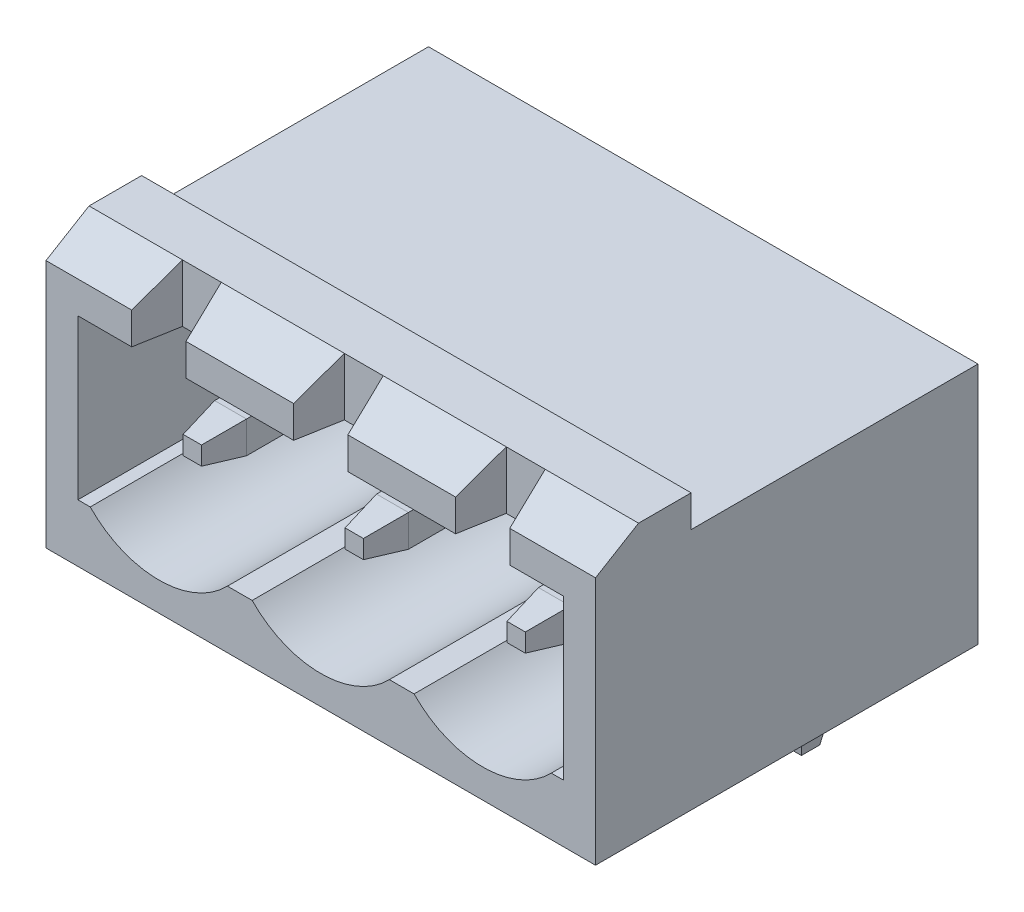
from build123d import *

# Parameters (mm, degrees)
SKETCH1_W           = 17.24
SKETCH1_H           = 7.62
BOSS_EXTRUDE1_DEPTH = 6
BOSS_EXTRUDE6_DEPTH = 17.24
CUT_EXTRUDE1_DEPTH  = 11.2
BOSS_EXTRUDE2_START = 2.5
BOSS_EXTRUDE2_DEPTH = 2.5
SKETCH4_R           = 1
BOSS_EXTRUDE3_DEPTH = 0.7
SKETCH5_W           = 1
SKETCH5_H           = 1
BOSS_EXTRUDE4_DEPTH = 5.75
SKETCH6_W           = 1
SKETCH6_H           = 1
BOSS_EXTRUDE5_DEPTH = 1.2
BOSS_EXTRUDE5_TAPER = 10
CUT_EXTRUDE2_START  = -1.81
CUT_EXTRUDE2_DEPTH  = 1.81
SKETCH10_W          = 1
SKETCH10_H          = 1
BOSS_EXTRUDE7_DEPTH = 2.3
SKETCH11_W          = 1
SKETCH11_H          = 1
BOSS_EXTRUDE8_DEPTH = 1.2
BOSS_EXTRUDE8_TAPER = 10
SKETCH12_W          = 2
SKETCH12_H          = 6.75
CUT_EXTRUDE3_DEPTH  = 0.5
LPATTERN1_COUNT     = 3
LPATTERN1_PITCH     = 5.08
LPATTERN2_COUNT     = 3
LPATTERN2_PITCH     = 5.08


with BuildPart() as part:
    # Sketch1 → Boss-Extrude1 (new, symmetric)
    with BuildSketch(Plane.XY):
        Rectangle(SKETCH1_W, SKETCH1_H)
    extrude(amount=BOSS_EXTRUDE1_DEPTH, both=True)

    # Sketch7 → Boss-Extrude6 (add)
    with BuildSketch(Plane(origin=(8.62, 0, 0), x_dir=(0, 0, -1), z_dir=(1, 0, 0))):
        Polygon((-6, 3.81), (-6, 4), (-4.65, 4.81), (-3, 4.81), (-3, 3.81), align=None)
    extrude(amount=-BOSS_EXTRUDE6_DEPTH)

    # Sketch2 → Cut-Extrude1 (cut)
    with BuildSketch(Plane.XY.offset(6)):
        with BuildLine():
            Line((2.927815064, -2), (2.54, -2))
            Line((2.54, -2), (2.54, 3))
            Line((2.54, 3), (7.62, 3))
            Line((7.62, 3), (7.62, -2))
            Line((7.62, -2), (7.232184936, -2))
            ThreePointArc((7.232184936, -2), (5.08, -2.91), (2.927815064, -2))
        make_face()
    cut_extrude1 = extrude(amount=-CUT_EXTRUDE1_DEPTH, mode=Mode.SUBTRACT)

    # Sketch3 → Boss-Extrude2 (add)
    with BuildSketch(Plane.XY.offset(-5.2).offset(BOSS_EXTRUDE2_START)):
        with BuildLine():
            Line((4.08, -1.028033989), (4.08, -2.738427125))
            ThreePointArc((4.08, -2.738427125), (5.08, -2.91), (6.08, -2.738427125))
            Line((6.08, -2.738427125), (6.08, -1.028033989))
            ThreePointArc((6.08, -1.028033989), (6.393299556, -0.634737384), (6.559019946, -0.16))
            Line((6.559019946, -0.16), (7.62, -0.16))
            Line((7.62, -0.16), (7.62, 0.34))
            Line((7.62, 0.34), (6.559019946, 0.34))
            ThreePointArc((6.559019946, 0.34), (6.140660172, 1.150660172), (5.33, 1.569019946))
            Line((5.33, 1.569019946), (5.33, 3))
            Line((5.33, 3), (4.83, 3))
            Line((4.83, 3), (4.83, 1.569019946))
            ThreePointArc((4.83, 1.569019946), (4.019339828, 1.150660172), (3.600980054, 0.34))
            Line((3.600980054, 0.34), (2.54, 0.34))
            Line((2.54, 0.34), (2.54, -0.16))
            Line((2.54, -0.16), (3.600980054, -0.16))
            ThreePointArc((3.600980054, -0.16), (3.766700444, -0.634737384), (4.08, -1.028033989))
        make_face()
    boss_extrude2 = extrude(amount=-BOSS_EXTRUDE2_DEPTH)

    # Sketch4 → Boss-Extrude3 (add)
    with BuildSketch(Plane.XY.offset(-2.7)):
        with Locations(Location((5.08, 0.09, 0), (0, 0, 180))):
            Circle(SKETCH4_R)
    boss_extrude3 = extrude(amount=BOSS_EXTRUDE3_DEPTH)

    # Sketch9 → Cut-Extrude2 (cut)
    with BuildSketch(Plane(origin=(0, 4.81, 0), x_dir=(1, 0, 0), z_dir=(0, 1, 0)).offset(CUT_EXTRUDE2_START)):
        Polygon((4.23, -6), (4.47, -4.65), (5.69, -4.65), (5.93, -6), align=None)
    cut_extrude2 = extrude(amount=CUT_EXTRUDE2_DEPTH, mode=Mode.SUBTRACT)

    # Sketch12 → Cut-Extrude3 (cut)
    with BuildSketch(Plane(origin=(0, 0, -6), x_dir=(-1, 0, 0), z_dir=(0, 0, -1))):
        with Locations((-5.08, -0.435)):
            Rectangle(SKETCH12_W, SKETCH12_H)
    cut_extrude3 = extrude(amount=-CUT_EXTRUDE3_DEPTH, mode=Mode.SUBTRACT)

    # LPattern1: Cut-Extrude1, Boss-Extrude2, Boss-Extrude3, Cut-Extrude2, Cut-Extrude3 ×3
    with Locations(*[(-i * LPATTERN1_PITCH, 0, 0) for i in range(1, LPATTERN1_COUNT)]):
        add(cut_extrude1, mode=Mode.SUBTRACT)
        add(boss_extrude2)
        add(boss_extrude3)
        add(cut_extrude2, mode=Mode.SUBTRACT)
        add(cut_extrude3, mode=Mode.SUBTRACT)


with BuildPart() as body_2:
    # Sketch5 → Boss-Extrude4 (new body)
    with BuildSketch(Plane.XY.offset(-2)):
        with Locations((5.08, 0.09)):
            Rectangle(SKETCH5_W, SKETCH5_H)
    extrude(amount=BOSS_EXTRUDE4_DEPTH)

    # Sketch6 → Boss-Extrude5 (add)
    with BuildSketch(Plane.XY.offset(3.75)):
        with Locations((5.08, 0.09)):
            Rectangle(SKETCH6_W, SKETCH6_H)
    extrude(amount=BOSS_EXTRUDE5_DEPTH, taper=BOSS_EXTRUDE5_TAPER)


with BuildPart() as body_3:
    # Sketch10 → Boss-Extrude7 (new body)
    with BuildSketch(Plane.XZ.offset(3.81)):
        with Locations((5.08, -4)):
            Rectangle(SKETCH10_W, SKETCH10_H)
    extrude(amount=BOSS_EXTRUDE7_DEPTH)

    # Sketch11 → Boss-Extrude8 (add)
    with BuildSketch(Plane.XZ.offset(6.11)):
        with Locations((5.08, -4)):
            Rectangle(SKETCH11_W, SKETCH11_H)
    extrude(amount=BOSS_EXTRUDE8_DEPTH, taper=BOSS_EXTRUDE8_TAPER)


with BuildPart() as lpattern2_1:
    # LPattern2: pattern copy
    add(body_3.part.moved(Location(Vector(-1, 0, 0) * (1 * LPATTERN2_PITCH))))


with BuildPart() as lpattern2_2:
    # LPattern2: pattern copy
    add(body_3.part.moved(Location(Vector(-1, 0, 0) * (2 * LPATTERN2_PITCH))))


with BuildPart() as lpattern2_3:
    # LPattern2: pattern copy
    add(body_2.part.moved(Location(Vector(-1, 0, 0) * (1 * LPATTERN2_PITCH))))


with BuildPart() as lpattern2_4:
    # LPattern2: pattern copy
    add(body_2.part.moved(Location(Vector(-1, 0, 0) * (2 * LPATTERN2_PITCH))))


solid = Compound([part.part, body_2.part, body_3.part, lpattern2_1.part, lpattern2_2.part, lpattern2_3.part, lpattern2_4.part])
